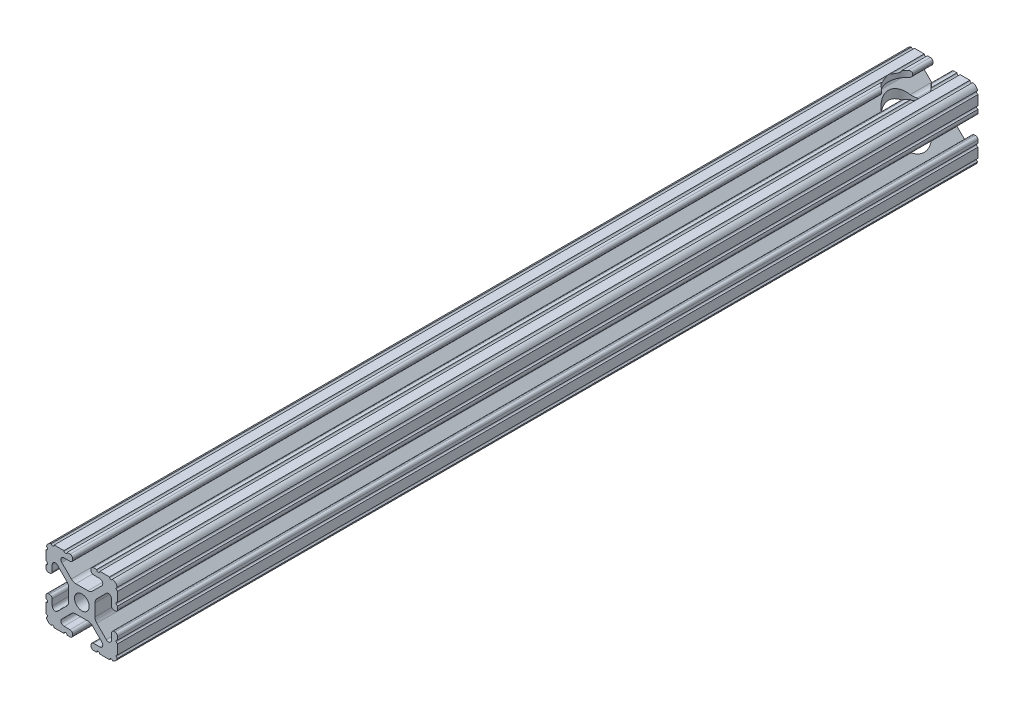
from build123d import *

# Parameters (mm, degrees)
SKETCH1_R           = 2.6035
BOSS_EXTRUDE1_DEPTH = 304.8
SKETCH3_R           = 6.35
CUT_EXTRUDE1_DEPTH  = 307.120058147


with BuildPart() as part:
    # Sketch1 → Boss-Extrude1 (new body)
    with BuildSketch(Plane.XY):
        with BuildLine():
            Line((-3.737334562, -5.299899128), (-7.103895736, -8.666460301))
            ThreePointArc((-7.103895736, -8.666460301), (-7.335478831, -9.830707141), (-6.348478019, -10.4902))
            Line((-6.348478019, -10.4902), (-4.190365, -10.4902))
            ThreePointArc((-4.190365, -10.4902), (-3.52627506, -10.76527506), (-3.2512, -11.429365))
            Line((-3.2512, -11.429365), (-3.2512, -11.760835))
            ThreePointArc((-3.2512, -11.760835), (-3.52627506, -12.42492494), (-4.190365, -12.7))
            Line((-4.190365, -12.7), (-5.243578019, -12.7))
            ThreePointArc((-5.243578019, -12.7), (-5.796028019, -12.14755), (-6.348478019, -12.7))
            Line((-6.348478019, -12.7), (-9.803703153, -12.7))
            ThreePointArc((-9.803703153, -12.7), (-10.295790179, -12.150857656), (-10.895412136, -12.579996867))
            ThreePointArc((-10.895412136, -12.579996867), (-11.943543586, -11.943543585), (-12.579996867, -10.895412135))
            ThreePointArc((-12.579996867, -10.895412135), (-12.150857661, -10.295790179), (-12.7, -9.803703154))
            Line((-12.7, -9.803703154), (-12.7, -6.348478019))
            ThreePointArc((-12.7, -6.348478019), (-12.14755, -5.796028019), (-12.7, -5.243578019))
            Line((-12.7, -5.243578019), (-12.7, -4.190365))
            ThreePointArc((-12.7, -4.190365), (-12.42492494, -3.52627506), (-11.760835, -3.2512))
            Line((-11.760835, -3.2512), (-11.429365, -3.2512))
            ThreePointArc((-11.429365, -3.2512), (-10.76527506, -3.52627506), (-10.4902, -4.190365))
            Line((-10.4902, -4.190365), (-10.4902, -6.348478019))
            ThreePointArc((-10.4902, -6.348478019), (-9.830707141, -7.335478831), (-8.666460302, -7.103895737))
            Line((-8.666460302, -7.103895737), (-5.299899128, -3.737334563))
            ThreePointArc((-5.299899128, -3.737334563), (-4.817571085, -3.015479635), (-4.6482, -2.163993691))
            Line((-4.6482, -2.163993691), (-4.6482, 2.16399369))
            ThreePointArc((-4.6482, 2.16399369), (-4.817571084, 3.015479634), (-5.299899127, 3.737334562))
            Line((-5.299899127, 3.737334562), (-8.666460301, 7.103895736))
            ThreePointArc((-8.666460301, 7.103895736), (-9.83070714, 7.335478831), (-10.490199999, 6.348478019))
            Line((-10.490199999, 6.348478019), (-10.490199999, 4.190365))
            ThreePointArc((-10.490199999, 4.190365), (-10.765275058, 3.52627506), (-11.429364999, 3.2512))
            Line((-11.429364999, 3.2512), (-11.760834999, 3.2512))
            ThreePointArc((-11.760834999, 3.2512), (-12.424924939, 3.52627506), (-12.699999999, 4.190365))
            Line((-12.699999999, 4.190365), (-12.699999999, 5.243578019))
            ThreePointArc((-12.699999999, 5.243578019), (-12.147549999, 5.796028019), (-12.699999999, 6.348478019))
            Line((-12.699999999, 6.348478019), (-12.699999999, 9.803703154))
            ThreePointArc((-12.699999999, 9.803703154), (-12.15085766, 10.295790179), (-12.579996866, 10.895412135))
            ThreePointArc((-12.579996866, 10.895412135), (-11.943543584, 11.943543586), (-10.895412134, 12.579996867))
            ThreePointArc((-10.895412134, 12.579996867), (-10.295790177, 12.150857661), (-9.803703152, 12.7))
            Line((-9.803703152, 12.7), (-6.348478018, 12.7))
            ThreePointArc((-6.348478018, 12.7), (-5.796028018, 12.14755), (-5.243578018, 12.7))
            Line((-5.243578018, 12.7), (-4.190364999, 12.7))
            ThreePointArc((-4.190364999, 12.7), (-3.526275058, 12.42492494), (-3.251199999, 11.760835))
            Line((-3.251199999, 11.760835), (-3.251199999, 11.429365))
            ThreePointArc((-3.251199999, 11.429365), (-3.526275058, 10.76527506), (-4.190364999, 10.4902))
            Line((-4.190364999, 10.4902), (-6.348478018, 10.4902))
            ThreePointArc((-6.348478018, 10.4902), (-7.33547883, 9.830707142), (-7.103895735, 8.666460303))
            Line((-7.103895735, 8.666460303), (-3.737334561, 5.299899129))
            ThreePointArc((-3.737334561, 5.299899129), (-3.015479634, 4.817571086), (-2.16399369, 4.6482))
            Line((-2.16399369, 4.6482), (2.163993692, 4.6482))
            ThreePointArc((2.163993692, 4.6482), (3.015479636, 4.817571085), (3.737334564, 5.299899128))
            Line((3.737334564, 5.299899128), (7.103895738, 8.666460302))
            ThreePointArc((7.103895738, 8.666460302), (7.335478833, 9.830707141), (6.348478021, 10.4902))
            Line((6.348478021, 10.4902), (4.190365002, 10.4902))
            ThreePointArc((4.190365002, 10.4902), (3.526275062, 10.76527506), (3.251200002, 11.429365))
            Line((3.251200002, 11.429365), (3.251200002, 11.760835))
            ThreePointArc((3.251200002, 11.760835), (3.526275062, 12.42492494), (4.190365002, 12.7))
            Line((4.190365002, 12.7), (5.243578021, 12.7))
            ThreePointArc((5.243578021, 12.7), (5.796028021, 12.14755), (6.348478021, 12.7))
            Line((6.348478021, 12.7), (9.803703155, 12.7))
            ThreePointArc((9.803703155, 12.7), (10.295790181, 12.150857656), (10.895412138, 12.579996867))
            ThreePointArc((10.895412138, 12.579996867), (11.943543588, 11.943543585), (12.579996869, 10.895412136))
            ThreePointArc((12.579996869, 10.895412136), (12.150857663, 10.295790179), (12.700000001, 9.803703154))
            Line((12.700000001, 9.803703154), (12.700000001, 6.34847802))
            ThreePointArc((12.700000001, 6.34847802), (12.147550001, 5.79602802), (12.700000001, 5.24357802))
            Line((12.700000001, 5.24357802), (12.700000001, 4.190365001))
            ThreePointArc((12.700000001, 4.190365001), (12.424924941, 3.526275061), (11.760835001, 3.251200001))
            Line((11.760835001, 3.251200001), (11.429365001, 3.251200001))
            ThreePointArc((11.429365001, 3.251200001), (10.765275061, 3.526275061), (10.490200001, 4.190365001))
            Line((10.490200001, 4.190365001), (10.490200001, 6.34847802))
            ThreePointArc((10.490200001, 6.34847802), (9.830707143, 7.335478832), (8.666460303, 7.103895738))
            Line((8.666460303, 7.103895738), (5.299899129, 3.737334564))
            ThreePointArc((5.299899129, 3.737334564), (4.817571086, 3.015479636), (4.648200001, 2.163993692))
            Line((4.648200001, 2.163993692), (4.648200001, -2.163993689))
            ThreePointArc((4.648200001, -2.163993689), (4.817571086, -3.015479633), (5.299899128, -3.737334561))
            Line((5.299899128, -3.737334561), (8.666460302, -7.103895735))
            ThreePointArc((8.666460302, -7.103895735), (9.830707141, -7.33547883), (10.4902, -6.348478018))
            Line((10.4902, -6.348478018), (10.4902, -4.190364999))
            ThreePointArc((10.4902, -4.190364999), (10.76527506, -3.526275059), (11.429365, -3.251199999))
            Line((11.429365, -3.251199999), (11.760835, -3.251199999))
            ThreePointArc((11.760835, -3.251199999), (12.42492494, -3.526275059), (12.7, -4.190364999))
            Line((12.7, -4.190364999), (12.7, -5.243578018))
            ThreePointArc((12.7, -5.243578018), (12.14755, -5.796028018), (12.7, -6.348478018))
            Line((12.7, -6.348478018), (12.7, -9.803703153))
            ThreePointArc((12.7, -9.803703153), (12.150857661, -10.295790178), (12.579996867, -10.895412134))
            ThreePointArc((12.579996867, -10.895412134), (11.943543586, -11.943543584), (10.895412136, -12.579996866))
            ThreePointArc((10.895412136, -12.579996866), (10.295790179, -12.150857655), (9.803703154, -12.699999999))
            Line((9.803703154, -12.699999999), (6.348478019, -12.699999999))
            ThreePointArc((6.348478019, -12.699999999), (5.796028019, -12.147549999), (5.243578019, -12.699999999))
            Line((5.243578019, -12.699999999), (4.190365, -12.699999999))
            ThreePointArc((4.190365, -12.699999999), (3.52627506, -12.424924939), (3.2512, -11.760834999))
            Line((3.2512, -11.760834999), (3.2512, -11.429364999))
            ThreePointArc((3.2512, -11.429364999), (3.52627506, -10.765275059), (4.190365, -10.490199999))
            Line((4.190365, -10.490199999), (6.348478019, -10.490199999))
            ThreePointArc((6.348478019, -10.490199999), (7.335478831, -9.830707141), (7.103895737, -8.666460301))
            Line((7.103895737, -8.666460301), (3.737334563, -5.299899128))
            ThreePointArc((3.737334563, -5.299899128), (3.015479635, -4.817571085), (2.163993691, -4.648199999))
            Line((2.163993691, -4.648199999), (-2.163993691, -4.648199999))
            ThreePointArc((-2.163993691, -4.648199999), (-3.015479635, -4.817571085), (-3.737334562, -5.299899128))
        make_face()
        with Locations(Location((0, 0, 0), (0, 0, 180))):
            Circle(SKETCH1_R, mode=Mode.SUBTRACT)
    extrude(amount=BOSS_EXTRUDE1_DEPTH)

    # Sketch3 → Cut-Extrude1 (cut, through all)
    with BuildSketch(Plane(origin=(0, 12.7, 0), x_dir=(1, 0, 0), z_dir=(0, 1, 0))):
        with Locations(Location((1e-09, -12.7, 0), (0, 0, 289.924793518))):
            Circle(SKETCH3_R)
    extrude(amount=-CUT_EXTRUDE1_DEPTH, mode=Mode.SUBTRACT)


solid = part.part
